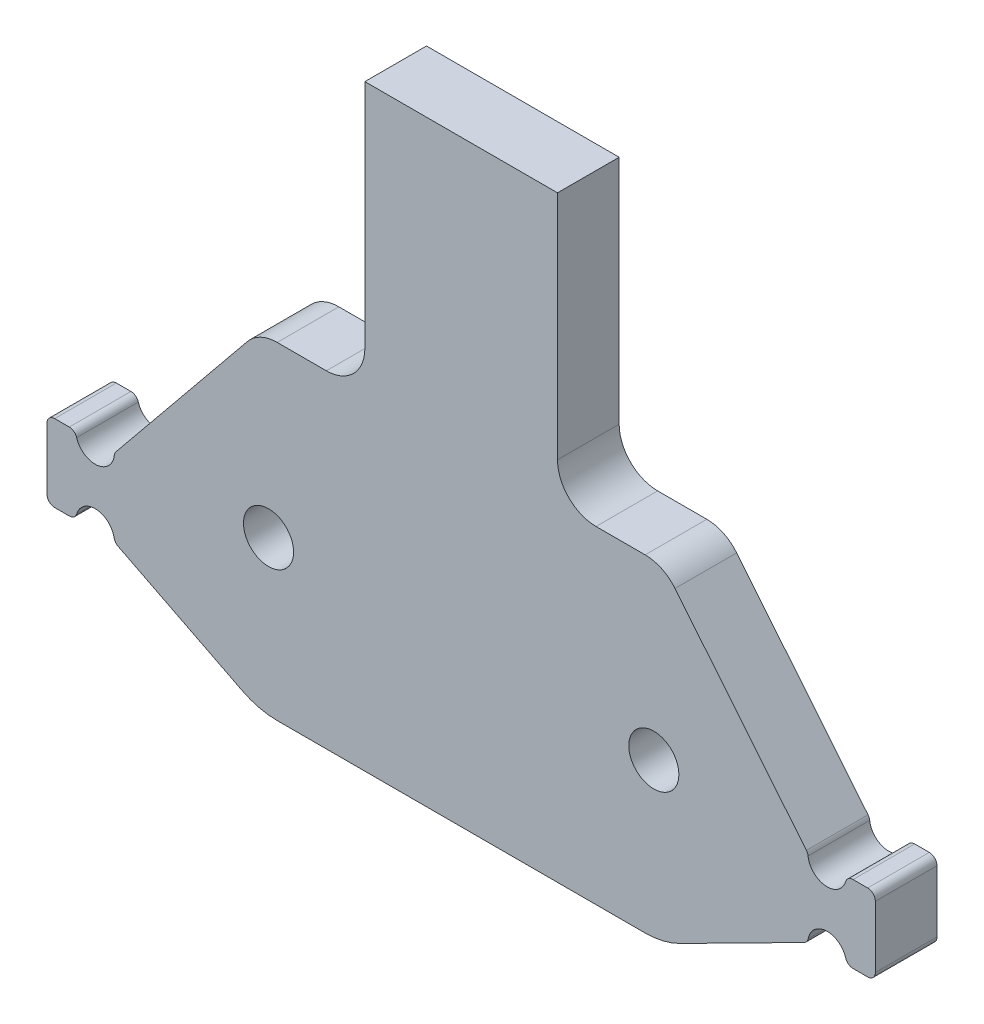
from build123d import *

# Parameters (mm, degrees)
EXTRUDE_3_DEPTH     = 16
SKETCH_8_R          = 5
CUT_EXTRUDE_3_DEPTH = 190.307289875
SKETCH_9_R          = 6.5
CUT_EXTRUDE_4_DEPTH = 190.307289875
FILLET_1_R          = 10
FILLET_2_R          = 20
FILLET_3_R          = 2
FILLET_4_R          = 10


with BuildPart() as part:
    # 草图1 → 凸台-拉伸3 (new body)
    with BuildSketch(Plane.XY):
        Polygon((52.5, 0), (90, 19), (107.5, 19), (107.5, 39), (90, 39), (52.5, 85), (25, 85), (25, 155), (-25, 155), (-25, 85), (-52.5, 85), (-90, 39), (-107.5, 39), (-107.5, 19), (-90, 19), (-52.5, 0), align=None)
    extrude(amount=EXTRUDE_3_DEPTH)

    # 草图8 → 切除-拉伸3 (cut, through all)
    with BuildSketch(Plane.XY.offset(16)):
        with Locations((-95, 39)):
            Circle(SKETCH_8_R)
        with Locations((-95, 19)):
            Circle(SKETCH_8_R)
        with Locations((95, 39)):
            Circle(SKETCH_8_R)
        with Locations((95, 19)):
            Circle(SKETCH_8_R)
    extrude(amount=-CUT_EXTRUDE_3_DEPTH, mode=Mode.SUBTRACT)

    # 草图9 → 切除-拉伸4 (cut, through all)
    with BuildSketch(Plane.XY.offset(16)):
        with Locations((-50, 40)):
            Circle(SKETCH_9_R)
        with Locations((50, 40)):
            Circle(SKETCH_9_R)
    extrude(amount=-CUT_EXTRUDE_4_DEPTH, mode=Mode.SUBTRACT)

    # 圆角1
    fillet_1_edges = [part.edges().sort_by_distance(p)[0] for p in [
        (-25, 85, 8),
        (25, 85, 8),
    ]]
    fillet(fillet_1_edges, radius=FILLET_1_R)

    # 圆角2
    fillet_2_edges = [part.edges().sort_by_distance(p)[0] for p in [
        (-52.5, 0, 8),
        (52.5, 0, 8),
    ]]
    fillet(fillet_2_edges, radius=FILLET_2_R)

    # 圆角3
    fillet_3_edges = [part.edges().sort_by_distance(p)[0] for p in [
        (-90, 19, 8),
        (-107.5, 19, 8),
        (-107.5, 39, 8),
        (-90, 39, 8),
        (90, 39, 8),
        (107.5, 39, 8),
        (107.5, 19, 8),
        (90, 19, 8),
        (-100, 19, 8),
        (100, 39, 8),
        (100, 19, 8),
        (-100, 39, 8),
    ]]
    fillet(fillet_3_edges, radius=FILLET_3_R)

    # 圆角4
    fillet_4_edges = [part.edges().sort_by_distance(p)[0] for p in [
        (-52.5, 85, 8),
        (52.5, 85, 8),
    ]]
    fillet(fillet_4_edges, radius=FILLET_4_R)


solid = part.part
